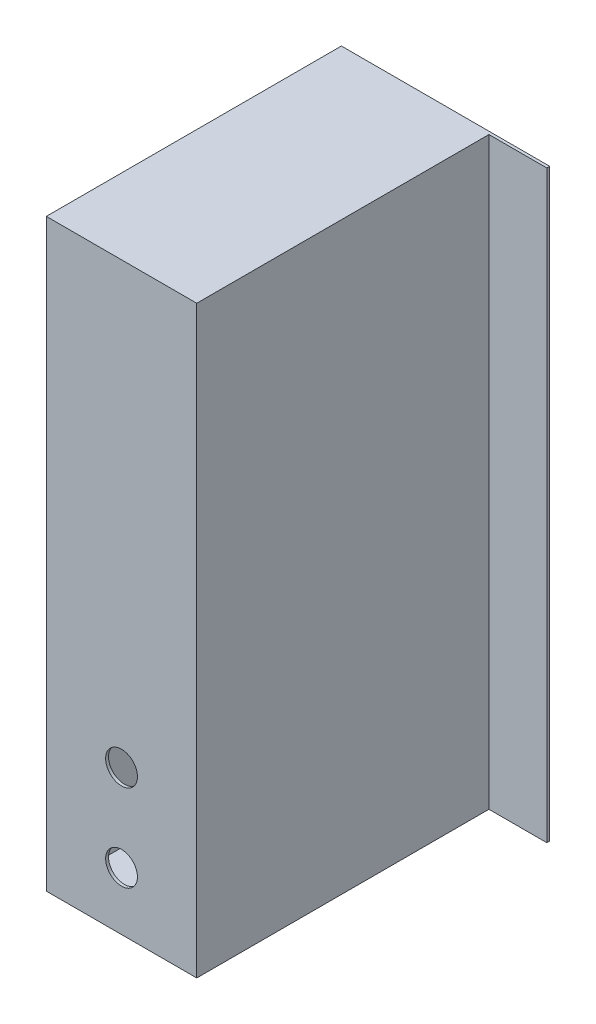
from build123d import *

# Parameters (mm, degrees)
ESQUISSE1_W             = 52
ESQUISSE1_H             = 202
BOSS_EXTRU_1_DEPTH      = 102
COQUE1_T                = -1
ESQUISSE2_W             = 50
ESQUISSE2_H             = 200
BOSS_EXTRU_2_DEPTH      = 1
ESQUISSE3_R             = 5.5
ENL_V_MAT_EXTRU_1_DEPTH = 1
ESQUISSE4_W             = 1
ESQUISSE4_H             = 202
BOSS_EXTRU_3_DEPTH      = 20


with BuildPart() as part:
    # Esquisse1 → Boss.-Extru.1 (new body)
    with BuildSketch(Plane.XY):
        Rectangle(ESQUISSE1_W, ESQUISSE1_H)
    extrude(amount=BOSS_EXTRU_1_DEPTH)

    # Coque1
    coque1_openings = [part.faces().sort_by_distance(p)[0] for p in [
        (0, 0, 102),
    ]]
    offset(amount=COQUE1_T, openings=coque1_openings, kind=Kind.INTERSECTION)

    # Esquisse2 → Boss.-Extru.2 (add)
    with BuildSketch(Plane.XY.offset(102)):
        Rectangle(ESQUISSE2_W, ESQUISSE2_H)
    extrude(amount=-BOSS_EXTRU_2_DEPTH)

    # Esquisse3 → Enlèv. mat.-Extru.1 (cut)
    with BuildSketch(Plane.XY.offset(102)):
        with Locations((0, -81)):
            Circle(ESQUISSE3_R)
        with Locations((0, -51)):
            Circle(ESQUISSE3_R)
    extrude(amount=-ENL_V_MAT_EXTRU_1_DEPTH, mode=Mode.SUBTRACT)

    # Esquisse4 → Boss.-Extru.3 (add)
    with BuildSketch(Plane(origin=(26, 0, 0), x_dir=(0, 0, -1), z_dir=(1, 0, 0))):
        with Locations((-0.5, 0)):
            Rectangle(ESQUISSE4_W, ESQUISSE4_H)
    extrude(amount=BOSS_EXTRU_3_DEPTH)


solid = part.part
